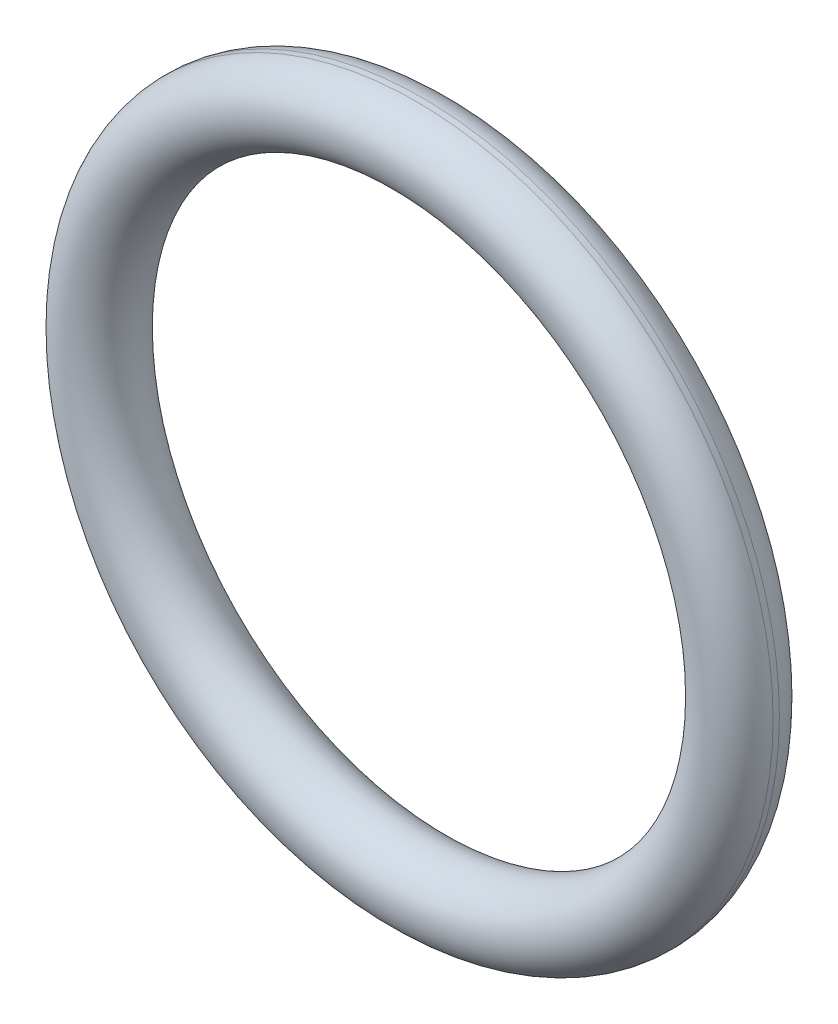
from build123d import *


with BuildPart() as part:
    # Sketch1 → Revolve1 (revolve)
    with BuildSketch(Plane(origin=(0, 0, 0), x_dir=(0, 0, -1), z_dir=(1, 0, 0)), mode=Mode.PRIVATE) as revolve1_sk:
        with BuildLine():
            Line((-0.25, 28.5), (0.25, 28.5))
            ThreePointArc((0.25, 28.5), (0, 22.510434814), (-0.25, 28.5))
        make_face()
    revolve(revolve1_sk.sketch.rotate(Axis((0, 0, 0), (0, 0, -1)), 90), axis=Axis((0, 0, 0), (0, 0, -1)))


solid = part.part
